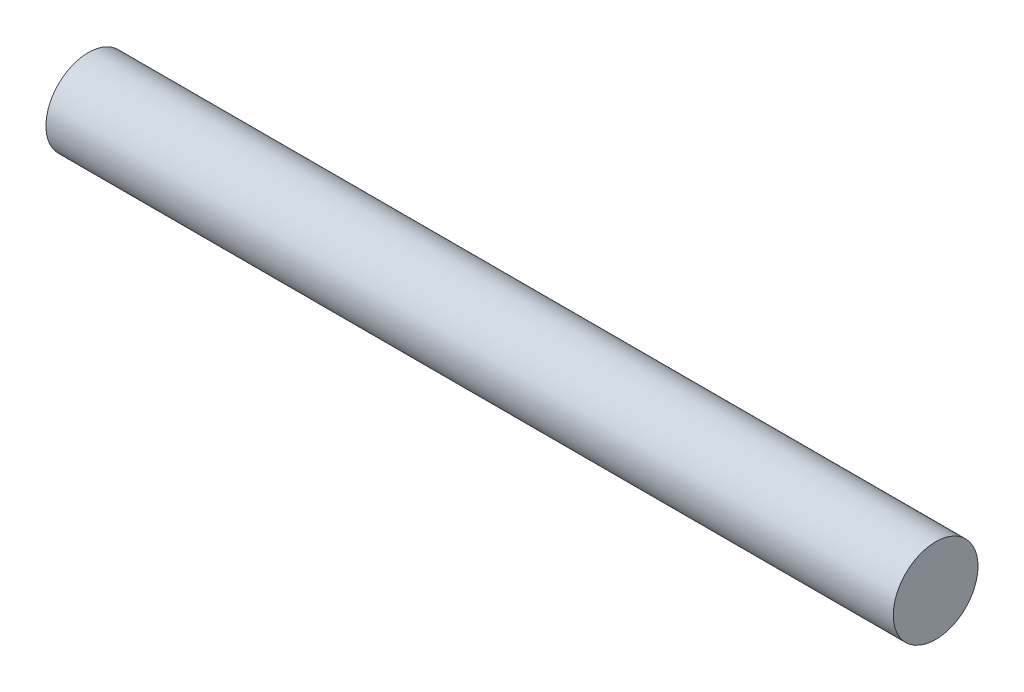
from build123d import *

# Parameters (mm, degrees)
SKETCH1_R           = 0.635
BOSS_EXTRUDE1_DEPTH = 12.7


with BuildPart() as part:
    # Sketch1 → Boss-Extrude1 (new body)
    with BuildSketch(Plane(origin=(0, 0, 0), x_dir=(0, 0, -1), z_dir=(1, 0, 0))):
        Circle(SKETCH1_R)
    extrude(amount=BOSS_EXTRUDE1_DEPTH)


solid = part.part
